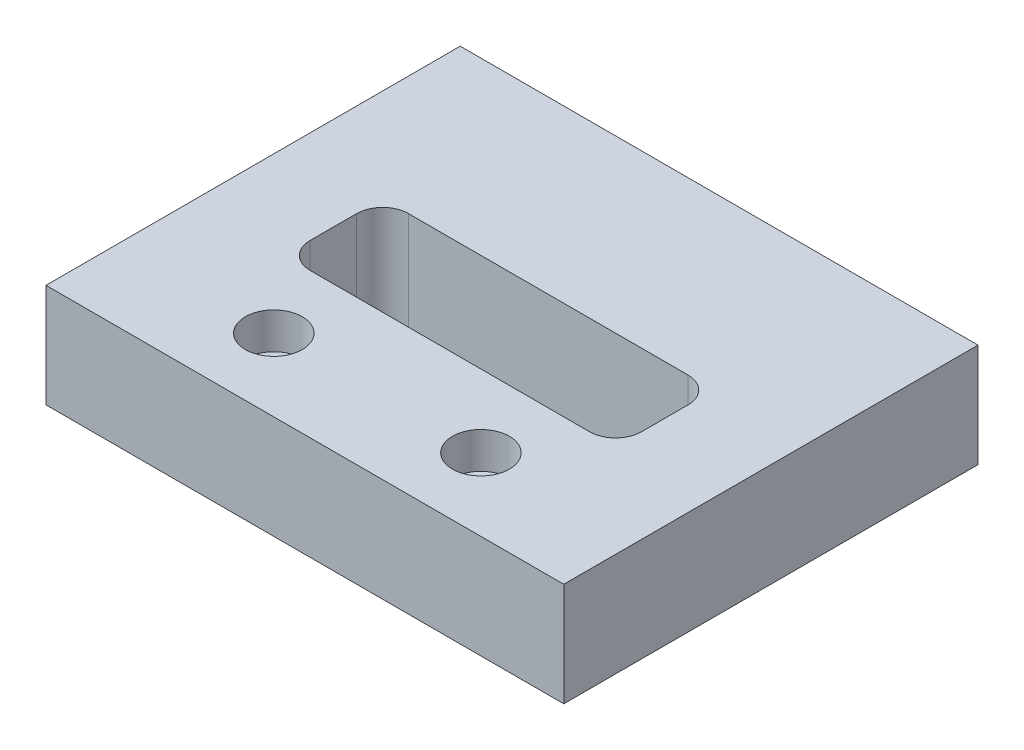
from build123d import *

# Parameters (mm, degrees)
SKETCH_1_W                = 100
SKETCH_1_H                = 80
SKETCH_1_W_2              = 64
SKETCH_1_H_2              = 19
EXTRUDE_1_DEPTH           = 20
FILLET_1_R                = 5
HOLE_WIZARD_1_D           = 6.4
HOLE_WIZARD_1_DEPTH       = 100
HOLE_WIZARD_1_CBORE_D     = 11
HOLE_WIZARD_1_CBORE_DEPTH = 7


with BuildPart() as part:
    # 草图1 → 凸台-拉伸1 (new body)
    with BuildSketch(Plane(origin=(0, 0, 0), x_dir=(1, 0, 0), z_dir=(0, 1, 0))):
        Rectangle(SKETCH_1_W, SKETCH_1_H)
        with Locations((0, -2.5)):
            Rectangle(SKETCH_1_W_2, SKETCH_1_H_2, mode=Mode.SUBTRACT)
    extrude(amount=EXTRUDE_1_DEPTH)

    # 圆角1
    fillet_1_edges = [part.edges().sort_by_distance(p)[0] for p in [
        (-32, 10, -7),
        (-32, 10, 12),
        (32, 10, 12),
        (32, 10, -7),
    ]]
    fillet(fillet_1_edges, radius=FILLET_1_R)

    # 孔1
    with Locations(Plane(origin=(0, 20, 0), x_dir=(1, 0, 0), z_dir=(0, 1, 0))):
        with Locations((20, -26), (-20, -26)):
            CounterBoreHole(HOLE_WIZARD_1_D / 2, HOLE_WIZARD_1_CBORE_D / 2, HOLE_WIZARD_1_CBORE_DEPTH, depth=HOLE_WIZARD_1_DEPTH)


solid = part.part
